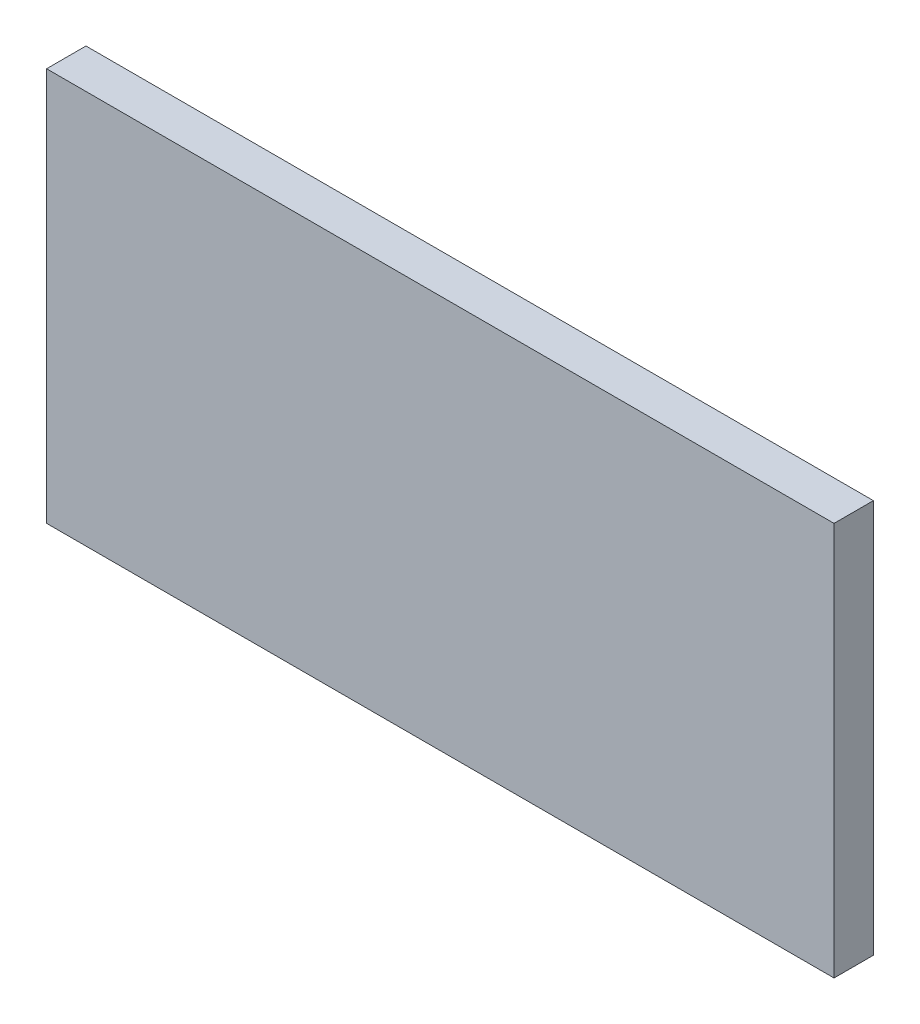
from build123d import *

# Parameters (mm, degrees)
SKETCH1_W           = 25.4
SKETCH1_H           = 12.7
BOSS_EXTRUDE1_DEPTH = 1.27


with BuildPart() as part:
    # Sketch1 → Boss-Extrude1 (new body)
    with BuildSketch(Plane.XY):
        with Locations((12.7, 6.35)):
            Rectangle(SKETCH1_W, SKETCH1_H)
    extrude(amount=BOSS_EXTRUDE1_DEPTH)


solid = part.part
